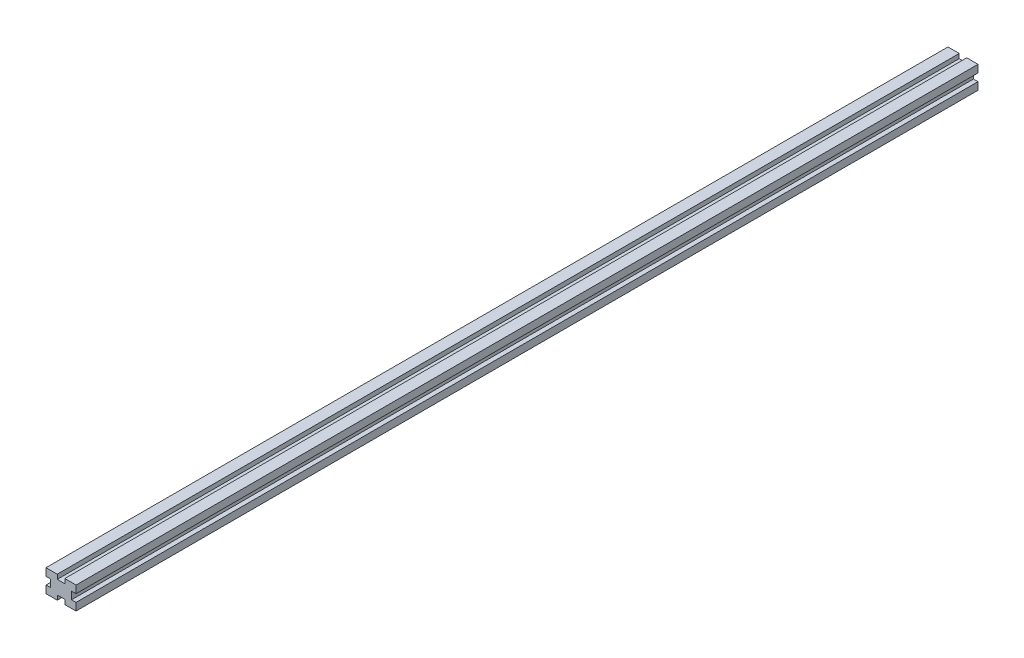
from build123d import *

# Parameters (mm, degrees)
SKETCH1_W           = 20
SKETCH1_H           = 15
BOSS_EXTRUDE1_DEPTH = 600
SKETCH2_W           = 5
SKETCH2_H           = 3
SKETCH2_W_2         = 3
SKETCH2_H_2         = 5
CUT_EXTRUDE1_DEPTH  = 700


with BuildPart() as part:
    # Sketch1 → Boss-Extrude1 (new body)
    with BuildSketch(Plane.XY):
        with Locations((10, 7.5)):
            Rectangle(SKETCH1_W, SKETCH1_H)
    extrude(amount=BOSS_EXTRUDE1_DEPTH)

    # Sketch2 → Cut-Extrude1 (cut)
    with BuildSketch(Plane.XY.offset(600)):
        with Locations((10, 13.5)):
            Rectangle(SKETCH2_W, SKETCH2_H)
        with Locations((18.5, 7.5)):
            Rectangle(SKETCH2_W_2, SKETCH2_H_2)
        with Locations((10, 1.5)):
            Rectangle(SKETCH2_W, SKETCH2_H)
        with Locations((1.5, 7.5)):
            Rectangle(SKETCH2_W_2, SKETCH2_H_2)
    extrude(amount=-CUT_EXTRUDE1_DEPTH, mode=Mode.SUBTRACT)


solid = part.part
